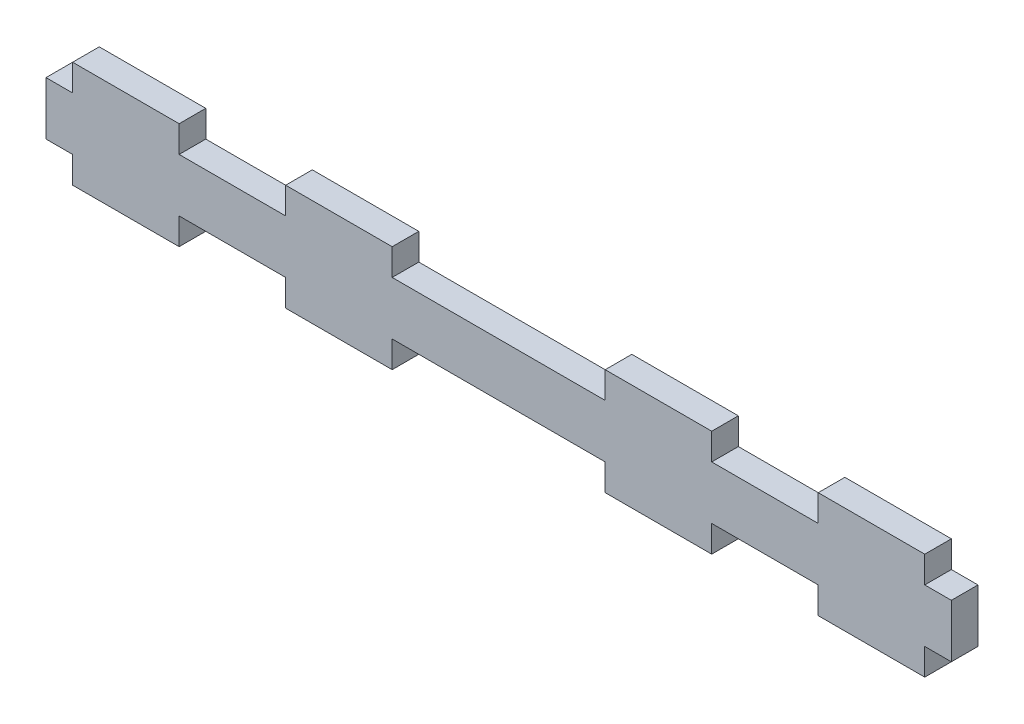
from build123d import *

# Parameters (mm, degrees)
BOSS_EXTRUDE1_DEPTH = 2.5


with BuildPart() as part:
    # Sketch1 → Boss-Extrude1 (new body)
    with BuildSketch(Plane.XY):
        Polygon((-42.5, 2.5), (-40, 2.5), (-40, 5), (-30, 5), (-30, 2.5), (-20, 2.5), (-20, 5), (-10, 5), (-10, 2.5), (10, 2.5), (10, 5), (20, 5), (20, 2.5), (30, 2.5), (30, 5), (40, 5), (40, 2.5), (42.5, 2.5), (42.5, -2.5), (40, -2.5), (40, -5), (30, -5), (30, -2.5), (20, -2.5), (20, -5), (10, -5), (10, -2.5), (-10, -2.5), (-10, -5), (-20, -5), (-20, -2.5), (-30, -2.5), (-30, -5), (-40, -5), (-40, -2.5), (-42.5, -2.5), align=None)
    extrude(amount=BOSS_EXTRUDE1_DEPTH)


solid = part.part
